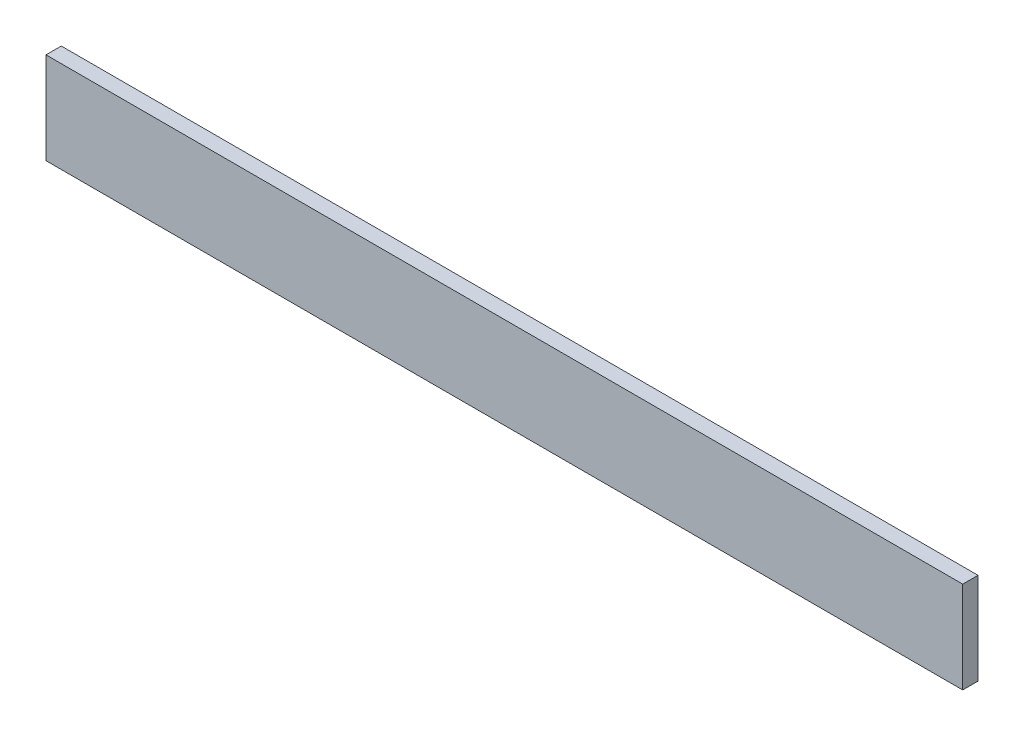
from build123d import *

# Parameters (mm, degrees)
ESQUISSE1_W        = 300
ESQUISSE1_H        = 30
BOSS_EXTRU_1_DEPTH = 5


with BuildPart() as part:
    # Esquisse1 → Boss.-Extru.1 (new body)
    with BuildSketch(Plane.XY):
        with Locations((-150, -15)):
            Rectangle(ESQUISSE1_W, ESQUISSE1_H)
    extrude(amount=BOSS_EXTRU_1_DEPTH)


solid = part.part
